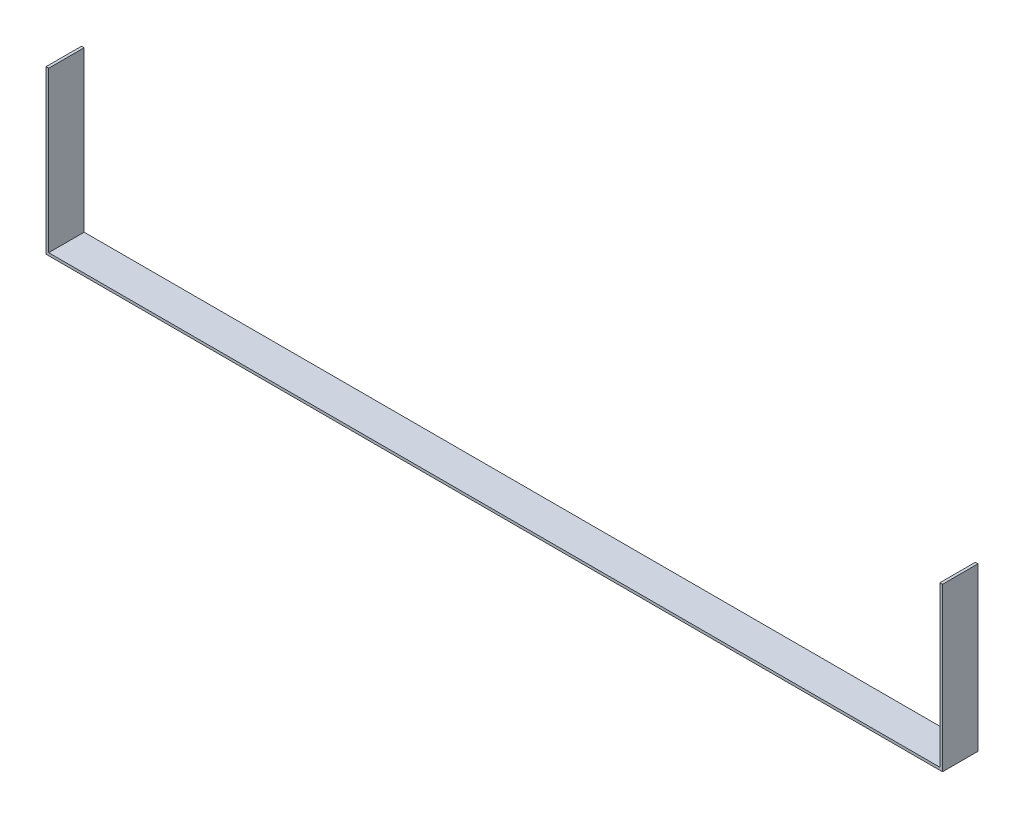
from build123d import *

# Parameters (mm, degrees)
BOSS_EXTRUDE1_DEPTH = 20


with BuildPart() as part:
    # Sketch1 → Boss-Extrude1 (new body)
    with BuildSketch(Plane.XY):
        Polygon((-251, 90), (-251, 0), (251, 0), (251, 90), (252.5, 90), (252.5, -1.5), (-252.5, -1.5), (-252.5, 90), align=None)
    extrude(amount=BOSS_EXTRUDE1_DEPTH)


solid = part.part
